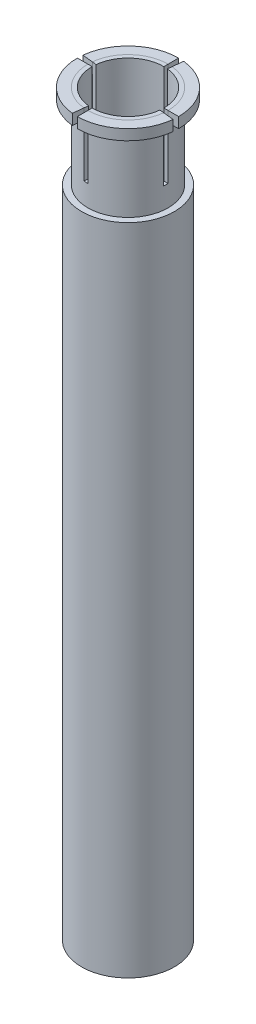
from build123d import *

# Parameters (mm, degrees)
SKETCH_1_R               = 19
SKETCH_1_R_2             = 17
EXTRUDE_1_DEPTH          = 50
CUT_EXTRUDE_1_DEPTH      = 30
PATTERN_CIRCULAR_1_COUNT = 4
EXTRUDE_1_2_DEPTH        = 5
EXTRUDE_1_2_2_DEPTH      = 5
EXTRUDE_1_2_3_DEPTH      = 5
EXTRUDE_1_2_4_DEPTH      = 5
SKETCH_6_R               = 22
SKETCH_6_R_2             = 20
EXTRUDE_3_DEPTH          = 310
EXTRUDE_START            = -10
SKETCH_7_R               = 20
SKETCH_7_R_2             = 19
EXTRUDE_4_DEPTH          = 10


with BuildPart() as part:
    # 草图1 → Extrude 1 (new body)
    with BuildSketch(Plane(origin=(0, 0, 0), x_dir=(1, 0, 0), z_dir=(0, 1, 0))):
        Circle(SKETCH_1_R)
        Circle(SKETCH_1_R_2, mode=Mode.SUBTRACT)
    extrude(amount=EXTRUDE_1_DEPTH)

    # 草图3 → 切除-拉伸1 (cut)
    with BuildSketch(Plane(origin=(0, 50, 0), x_dir=(1, 0, 0), z_dir=(0, 1, 0))):
        Polygon((0, 0), (0, 19), (2, 19), align=None)
    cut_extrude_1 = extrude(amount=-CUT_EXTRUDE_1_DEPTH, mode=Mode.SUBTRACT)

    # 阵列(圆周)1: 切除-拉伸1 ×4 about axis
    pattern_circular_1_axis = Axis((0, 50, 0), (0, -1, 0))
    for i in range(1, PATTERN_CIRCULAR_1_COUNT):
        add(cut_extrude_1.rotate(pattern_circular_1_axis, i * 360 / PATTERN_CIRCULAR_1_COUNT), mode=Mode.SUBTRACT)



with BuildPart() as body_2:
    # 草图4 → Extrude 1 2 (new body)
    with BuildSketch(Plane(origin=(0, 50, 0), x_dir=(1, 0, 0), z_dir=(0, 1, 0))):
        with BuildLine():
            Line((0, 19), (0, 24))
            ThreePointArc((0, 24), (-16.057732781, 17.836737873), (-23.86813087, 2.512434828))
            Line((-23.86813087, 2.512434828), (-18.895603606, 1.989010906))
            ThreePointArc((-18.895603606, 1.989010906), (-12.712371785, 14.120750816), (0, 19))
        make_face()
    extrude(amount=-EXTRUDE_1_2_DEPTH)


with BuildPart() as body_3:
    # 草图4 → Extrude 1 2 2 (new body)
    with BuildSketch(Plane(origin=(0, 50, 0), x_dir=(1, 0, 0), z_dir=(0, 1, 0))):
        with BuildLine():
            Line((1.989010906, 18.895603606), (2.512434828, 23.86813087))
            ThreePointArc((2.512434828, 23.86813087), (17.836737873, 16.057732781), (24, 0))
            Line((24, 0), (19, 0))
            ThreePointArc((19, 0), (14.120750816, 12.712371785), (1.989010906, 18.895603606))
        make_face()
    extrude(amount=-EXTRUDE_1_2_2_DEPTH)


with BuildPart() as body_4:
    # 草图4 → Extrude 1 2 3 (new body)
    with BuildSketch(Plane(origin=(0, 50, 0), x_dir=(1, 0, 0), z_dir=(0, 1, 0))):
        with BuildLine():
            Line((18.895603606, -1.989010906), (23.86813087, -2.512434828))
            ThreePointArc((23.86813087, -2.512434828), (16.057732781, -17.836737873), (0, -24))
            Line((0, -24), (0, -19))
            ThreePointArc((0, -19), (12.712371785, -14.120750816), (18.895603606, -1.989010906))
        make_face()
    extrude(amount=-EXTRUDE_1_2_3_DEPTH)


with BuildPart() as body_5:
    # 草图4 → Extrude 1 2 4 (new body)
    with BuildSketch(Plane(origin=(0, 50, 0), x_dir=(1, 0, 0), z_dir=(0, 1, 0))):
        with BuildLine():
            Line((-1.989010906, -18.895603606), (-2.512434828, -23.86813087))
            ThreePointArc((-2.512434828, -23.86813087), (-17.836737873, -16.057732781), (-24, 0))
            Line((-24, 0), (-19, 0))
            ThreePointArc((-19, 0), (-14.120750816, -12.712371785), (-1.989010906, -18.895603606))
        make_face()
    extrude(amount=-EXTRUDE_1_2_4_DEPTH)


with BuildPart() as body_6:
    # 草图6 → 凸台-拉伸3 (new body)
    with BuildSketch(Plane(origin=(0, 10, 0), x_dir=(1, 0, 0), z_dir=(0, 1, 0))):
        with Locations(Location((0, 0, 0), (0, 0, 270))):
            Circle(SKETCH_6_R)
        with Locations(Location((0, 0, 0), (0, 0, 270))):
            Circle(SKETCH_6_R_2, mode=Mode.SUBTRACT)
    extrude(amount=-EXTRUDE_3_DEPTH)


with BuildPart() as part_1:
    add(part.part)

    add(body_6.part)  # 凸台-拉伸4 merges body 6
    # 草图7 → 凸台-拉伸4 (add)
    with BuildSketch(Plane(origin=(0, 10, 0), x_dir=(1, 0, 0), z_dir=(0, 1, 0)).offset(EXTRUDE_START)):
        with Locations(Location((0, 0, 0), (0, 0, 270))):
            Circle(SKETCH_7_R)
        with Locations(Location((0, 0, 0), (0, 0, 270))):
            Circle(SKETCH_7_R_2, mode=Mode.SUBTRACT)
    extrude(amount=EXTRUDE_4_DEPTH)


solid = Compound([body_2.part, body_3.part, body_4.part, body_5.part, part_1.part])
